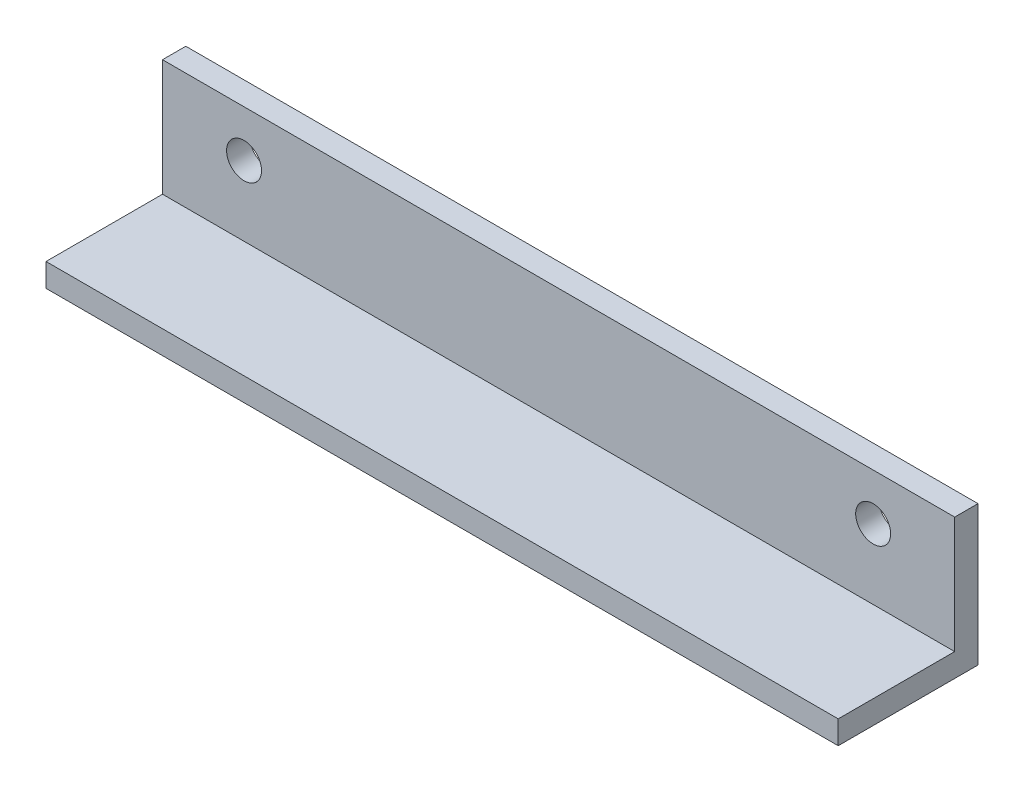
from build123d import *

# Parameters (mm, degrees)
EXTRUDE_THIN1_DEPTH          = 107.95
F_3_8_0_375_DIAMETER_HOLE1_D = 9.525


with BuildPart() as part:
    # Sketch1 → Extrude-Thin1 (new, symmetric)
    with BuildSketch(Plane(origin=(0, 0, 0), x_dir=(0, 0, -1), z_dir=(1, 0, 0))):
        Polygon((-38.1, 0), (0, 0), (0, 38.1), (-6.35, 38.1), (-6.35, 6.35), (-38.1, 6.35), align=None)
    extrude(amount=EXTRUDE_THIN1_DEPTH, both=True)

    # 3/8 (0.375) Diameter Hole1 (through all)
    with Locations(Plane.XY.offset(6.35)):
        with Locations((-85.725, 25.4), (85.725, 25.4)):
            Hole(F_3_8_0_375_DIAMETER_HOLE1_D / 2)


solid = part.part
